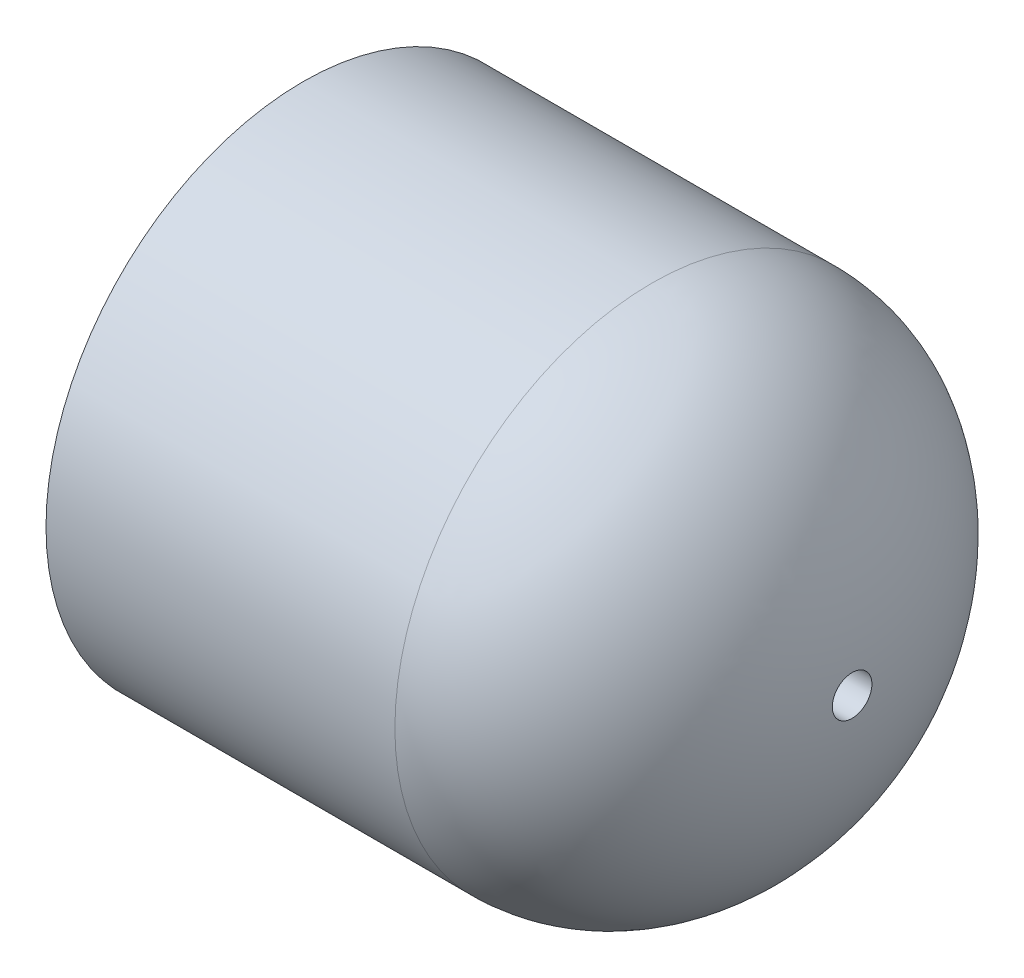
from build123d import *

# Parameters (mm, degrees)
SKETCH2_R          = 1.5875
CUT_EXTRUDE2_DEPTH = 25.4


with BuildPart() as part:
    # Sketch1 → Revolve1 (revolve)
    with BuildSketch(Plane.XY, mode=Mode.PRIVATE) as revolve1_sk:
        with BuildLine():
            Line((18.0594, 0), (22.0091, 0))
            add(Edge.make_bspline(
                [(5.9309, -20.5867), (22.0091, -20.5867), (22.0091, 0)],
                knots=[3.141592654, 3.141592654, 3.141592654, 4.71238898, 4.71238898, 4.71238898], degree=2, weights=[1, 0.707106781, 1]))
            Line((5.9309, -20.5867), (-22.0091, -20.5867))
            Line((-22.0091, -20.5867), (-22.0091, -16.8275))
            Line((-22.0091, -16.8275), (5.9309, -16.637))
            add(Edge.make_bspline(
                [(5.9309, -16.637), (18.0594, -16.637), (18.0594, 0)],
                knots=[0, 0, 0, 1.570796327, 1.570796327, 1.570796327], degree=2, weights=[1, 0.707106781, 1]))
        make_face()
    revolve(revolve1_sk.sketch.rotate(Axis((-22.0091, 0, 0), (1, 0, 0)), 270), axis=Axis((-22.0091, 0, 0), (1, 0, 0)))

    # Sketch2 → Cut-Extrude2 (cut, symmetric)
    with BuildSketch(Plane(origin=(0, 0, 0), x_dir=(0, 0, -1), z_dir=(1, 0, 0))):
        with Locations(Location((0, 0, 0), (0, 0, 180))):
            Circle(SKETCH2_R)
    extrude(amount=CUT_EXTRUDE2_DEPTH, both=True, mode=Mode.SUBTRACT)


solid = part.part
